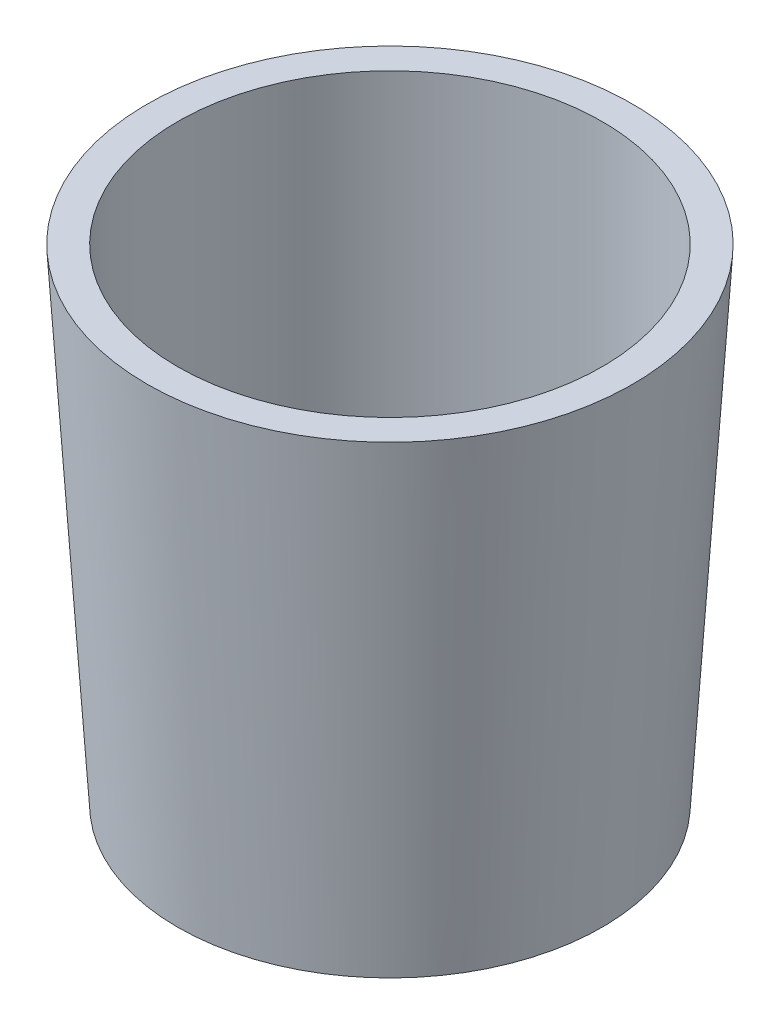
from build123d import *

# Parameters (mm, degrees)
CROQUIS2_R            = 40
CROQUIS1_R            = 35
CROQUIS3_R            = 35
CORTAR_EXTRUIR2_DEPTH = 75


with BuildPart() as part:
    # Croquis2 → Recubrir1 section 0
    with BuildSketch(Plane(origin=(0, 80, 0), x_dir=(1, 0, 0), z_dir=(0, 1, 0))):
        Circle(CROQUIS2_R)
    # Croquis1 → Recubrir1 section 1
    with BuildSketch(Plane(origin=(0, 0, 0), x_dir=(1, 0, 0), z_dir=(0, 1, 0))):
        Circle(CROQUIS1_R)
    loft()

    # Croquis3 → Cortar-Extruir2 (cut)
    with BuildSketch(Plane(origin=(0, 80, 0), x_dir=(1, 0, 0), z_dir=(0, 1, 0))):
        with Locations(Location((0, 0, 0), (0, 0, 270))):
            Circle(CROQUIS3_R)
    extrude(amount=-CORTAR_EXTRUIR2_DEPTH, mode=Mode.SUBTRACT)


solid = part.part
